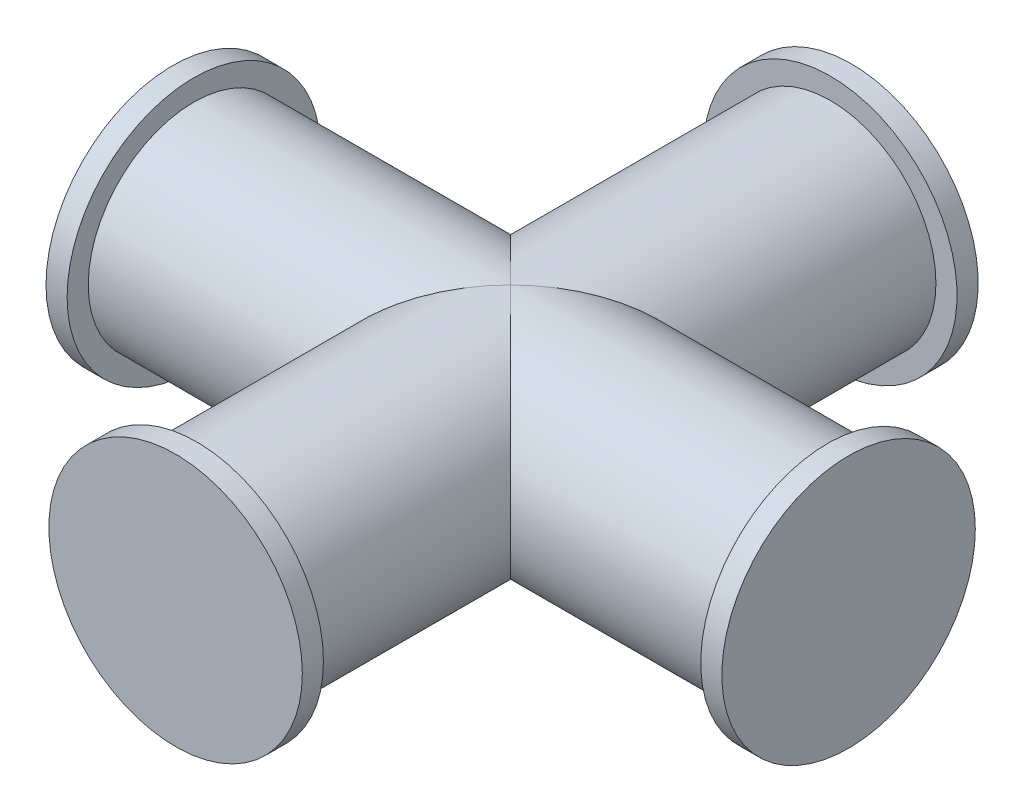
from build123d import *

# Parameters (mm, degrees)
SKETCH1_R           = 10
BOSS_EXTRUDE1_DEPTH = 60
SKETCH2_R           = 12
BOSS_EXTRUDE2_DEPTH = 2
BOSS_EXTRUDE3_START = 2
SKETCH3_R           = 12
BOSS_EXTRUDE3_DEPTH = 2
SKETCH4_R           = 10
BOSS_EXTRUDE4_DEPTH = 30
SKETCH5_R           = 12
BOSS_EXTRUDE5_DEPTH = 2
BOSS_EXTRUDE6_START = 2
SKETCH6_R           = 12
BOSS_EXTRUDE6_DEPTH = 2


with BuildPart() as part:
    # Sketch1 → Boss-Extrude1 (new body)
    with BuildSketch(Plane.XY):
        Circle(SKETCH1_R)
    extrude(amount=BOSS_EXTRUDE1_DEPTH)

    # Sketch2 → Boss-Extrude2 (add)
    with BuildSketch(Plane.XY.offset(60)):
        Circle(SKETCH2_R)
    extrude(amount=BOSS_EXTRUDE2_DEPTH)

    # Sketch3 → Boss-Extrude3 (add)
    with BuildSketch(Plane(origin=(0, 0, 0), x_dir=(-1, 0, 0), z_dir=(0, 0, -1)).offset(BOSS_EXTRUDE3_START)):
        with Locations(Location((0, 0, 0), (0, 0, 180))):
            Circle(SKETCH3_R)
    extrude(amount=-BOSS_EXTRUDE3_DEPTH)

    # Sketch4 → Boss-Extrude4 (add, symmetric)
    with BuildSketch(Plane(origin=(0, 0, 0), x_dir=(0, 0, -1), z_dir=(1, 0, 0))):
        with Locations(Location((-30.27140407, 0, 0), (0, 0, 270))):
            Circle(SKETCH4_R)
    extrude(amount=BOSS_EXTRUDE4_DEPTH, both=True)

    # Sketch5 → Boss-Extrude5 (add)
    with BuildSketch(Plane(origin=(30, 0, 0), x_dir=(0, 0, -1), z_dir=(1, 0, 0))):
        with Locations((-30.27140407, 0)):
            Circle(SKETCH5_R)
    extrude(amount=BOSS_EXTRUDE5_DEPTH)

    # Sketch6 → Boss-Extrude6 (add)
    with BuildSketch(Plane.ZY.offset(30).offset(BOSS_EXTRUDE6_START)):
        with Locations(Location((30.27140407, 0, 0), (0, 0, 180))):
            Circle(SKETCH6_R)
    extrude(amount=-BOSS_EXTRUDE6_DEPTH)


solid = part.part
